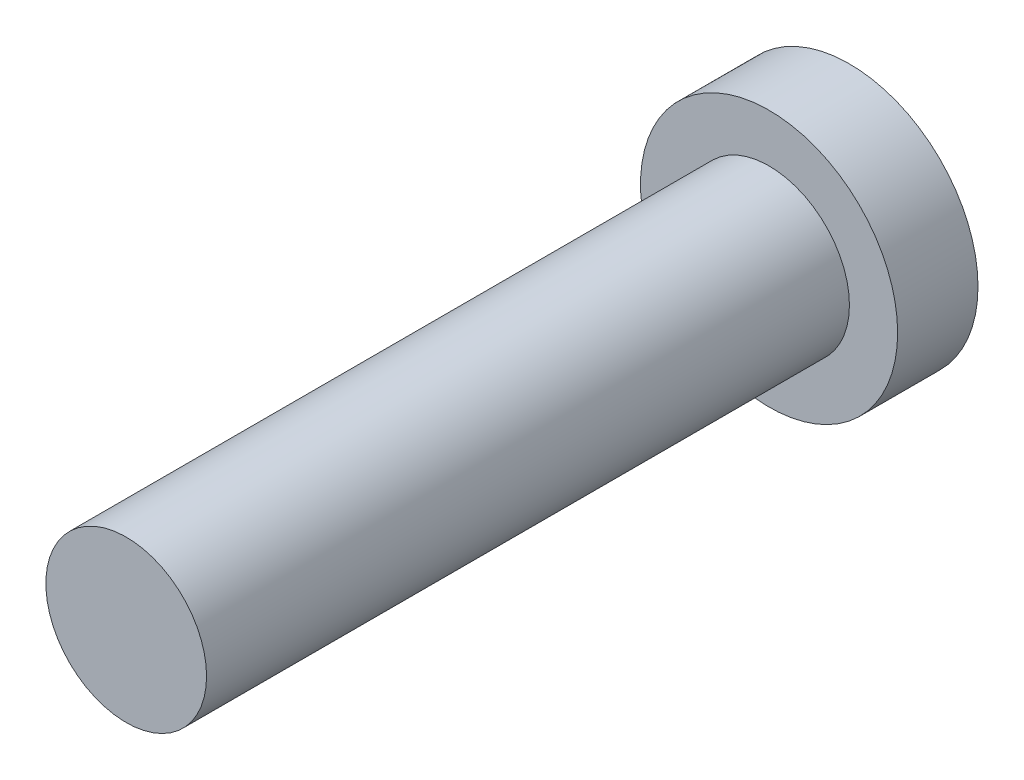
from build123d import *

# Parameters (mm, degrees)
SKETCH1_R           = 8
BOSS_EXTRUDE1_DEPTH = 5
SKETCH2_R           = 5
BOSS_EXTRUDE2_DEPTH = 40


with BuildPart() as part:
    # Sketch1 → Boss-Extrude1 (new body)
    with BuildSketch(Plane.XY):
        Circle(SKETCH1_R)
    extrude(amount=BOSS_EXTRUDE1_DEPTH)

    # Sketch2 → Boss-Extrude2 (add)
    with BuildSketch(Plane.XY.offset(5)):
        Circle(SKETCH2_R)
    extrude(amount=BOSS_EXTRUDE2_DEPTH)


solid = part.part
